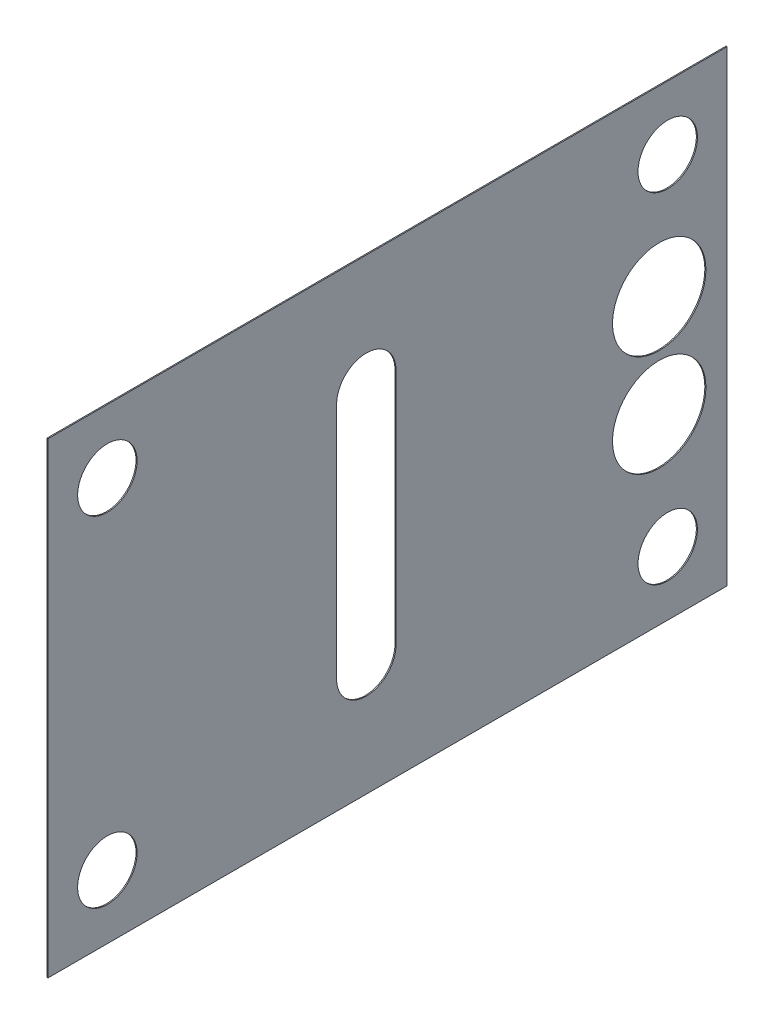
from build123d import *

# Parameters (mm, degrees)
SKETCH1_W             = 160
SKETCH1_H             = 110
BOSS_EXTRUDE1_DEPTH   = 0.254
M12_CLEARANCE_HOLE1_D = 14
CUT_EXTRUDE1_DEPTH    = 98.082771468
M20_CLEARANCE_HOLE1_D = 22


with BuildPart() as part:
    # Sketch1 → Boss-Extrude1 (new body)
    with BuildSketch(Plane(origin=(0, 0, 0), x_dir=(0, 0, -1), z_dir=(1, 0, 0))):
        Rectangle(SKETCH1_W, SKETCH1_H)
    extrude(amount=BOSS_EXTRUDE1_DEPTH)

    # M12 Clearance Hole1 (through all)
    with Locations(Plane(origin=(0.254, 0, 0), x_dir=(0, 0, -1), z_dir=(1, 0, 0))):
        with Locations((-66, 40), (66, 40), (66, -40), (-66, -40)):
            Hole(M12_CLEARANCE_HOLE1_D / 2)

    # Sketch4 → Cut-Extrude1 (cut, through all)
    with BuildSketch(Plane(origin=(0.254, 0, 0), x_dir=(0, 0, -1), z_dir=(1, 0, 0))):
        with BuildLine():
            Line((2, 28), (2, -28))
            ThreePointArc((2, -28), (-5, -35), (-12, -28))
            Line((-12, -28), (-12, 28))
            ThreePointArc((-12, 28), (-5, 35), (2, 28))
        make_face()
    extrude(amount=-CUT_EXTRUDE1_DEPTH, mode=Mode.SUBTRACT)

    # M20 Clearance Hole1 (through all)
    with Locations(Plane(origin=(0.254, 0, 0), x_dir=(0, 0, -1), z_dir=(1, 0, 0))):
        with Locations((64, 12), (64, -12)):
            Hole(M20_CLEARANCE_HOLE1_D / 2)


solid = part.part
